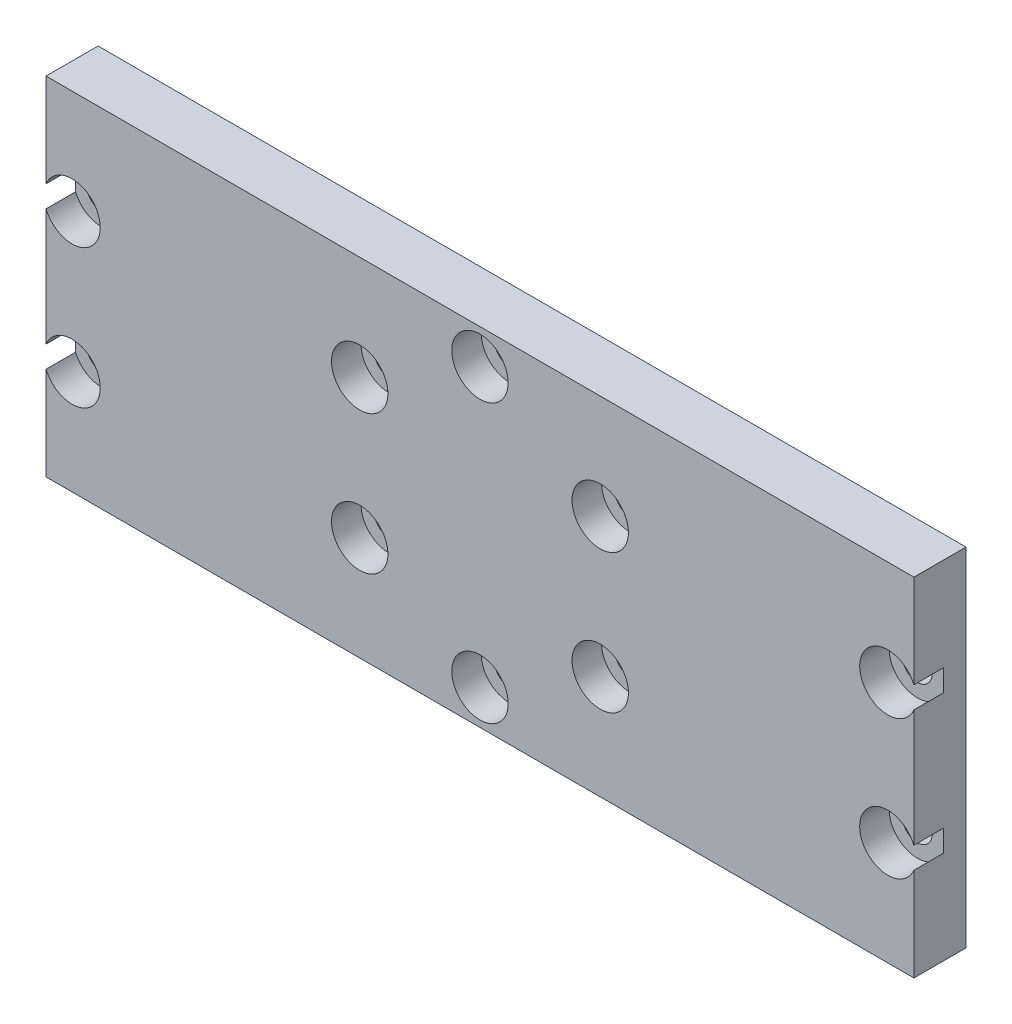
from build123d import *

# Parameters (mm, degrees)
SKETCH1_W                                           = 100
SKETCH1_H                                           = 40
BOSS_EXTRUDE1_DEPTH                                 = 6
CBORE_FOR_M3_HEX_SOCKET_HEAD_CAP_SCREW1_D           = 3.4
CBORE_FOR_M3_HEX_SOCKET_HEAD_CAP_SCREW1_CBORE_D     = 6.5
CBORE_FOR_M3_HEX_SOCKET_HEAD_CAP_SCREW1_CBORE_DEPTH = 3.4
CBORE_FOR_M3_HEX_SOCKET_HEAD_CAP_SCREW2_D           = 3.4
CBORE_FOR_M3_HEX_SOCKET_HEAD_CAP_SCREW2_CBORE_D     = 6.5
CBORE_FOR_M3_HEX_SOCKET_HEAD_CAP_SCREW2_CBORE_DEPTH = 3.4


with BuildPart() as part:
    # Sketch1 → Boss-Extrude1 (new body)
    with BuildSketch(Plane.XY):
        with Locations((50, 20)):
            Rectangle(SKETCH1_W, SKETCH1_H)
    extrude(amount=BOSS_EXTRUDE1_DEPTH)

    # CBORE for M3 Hex Socket Head Cap Screw1 (through all)
    with Locations(Plane.XY.offset(6)):
        with Locations((3, 28), (97, 28), (97, 12), (3, 12)):
            CounterBoreHole(CBORE_FOR_M3_HEX_SOCKET_HEAD_CAP_SCREW1_D / 2, CBORE_FOR_M3_HEX_SOCKET_HEAD_CAP_SCREW1_CBORE_D / 2, CBORE_FOR_M3_HEX_SOCKET_HEAD_CAP_SCREW1_CBORE_DEPTH)

    # CBORE for M3 Hex Socket Head Cap Screw2 (through all)
    with Locations(Plane.XY.offset(6)):
        with Locations((36.143593539, 28), (50, 36), (63.856406461, 28), (63.856406461, 12), (50, 4), (36.143593539, 12)):
            CounterBoreHole(CBORE_FOR_M3_HEX_SOCKET_HEAD_CAP_SCREW2_D / 2, CBORE_FOR_M3_HEX_SOCKET_HEAD_CAP_SCREW2_CBORE_D / 2, CBORE_FOR_M3_HEX_SOCKET_HEAD_CAP_SCREW2_CBORE_DEPTH)


solid = part.part
